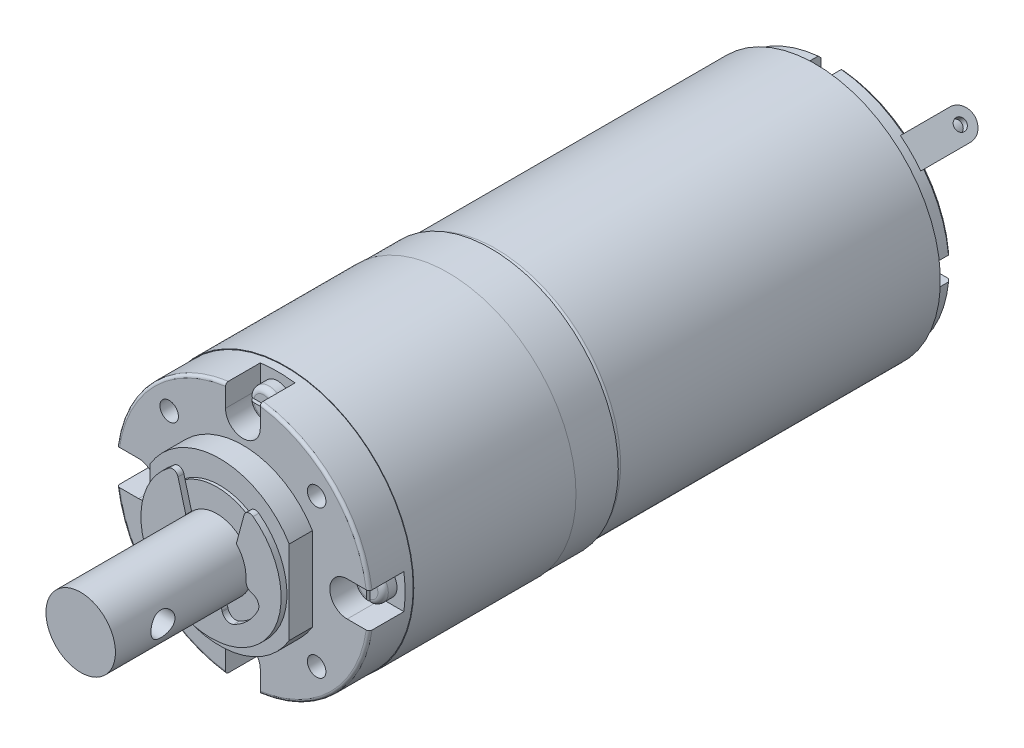
from build123d import *

# Parameters (mm, degrees)
SKETCH1_R           = 11
BOSS_EXTRUDE1_DEPTH = 25.45
SKETCH2_R           = 11
SKETCH2_R_2         = 10.8
CUT_EXTRUDE1_DEPTH  = 34.350412291
SKETCH5_R           = 0.8
CUT_EXTRUDE2_DEPTH  = 3
BOSS_EXTRUDE2_DEPTH = 2
SKETCH7_R           = 3
BOSS_EXTRUDE3_DEPTH = 12
CUT_EXTRUDE3_START  = -1
CUT_EXTRUDE3_DEPTH  = 1
CIRPATTERN1_COUNT   = 4
CIRPATTERN2_COUNT   = 4
SKETCH11_R          = 5
BOSS_EXTRUDE4_DEPTH = 0.25
SKETCH12_R          = 11.05
BOSS_EXTRUDE5_DEPTH = 7
SKETCH14_R          = 1.0375
CUT_EXTRUDE4_DEPTH  = 3
FILLET1_R           = 0.25
BOSS_EXTRUDE6_DEPTH = 0.5
FILLET2_R           = 0.5
CUT_EXTRUDE5_START  = -1.5
SKETCH16_R          = 10.8
SKETCH16_R_2        = 10.3
CUT_EXTRUDE5_DEPTH  = 1.5
CUT_EXTRUDE6_START  = -0.5
CUT_EXTRUDE6_DEPTH  = 0.5
CUT_EXTRUDE7_START  = -1.5
CUT_EXTRUDE7_DEPTH  = 1.5
CHAMFER1_SIZE       = 0.25
CUT_EXTRUDE8_DEPTH  = 0.5
SKETCH20_R          = 0.5
BOSS_EXTRUDE7_DEPTH = 0.5
CIRPATTERN4_COUNT   = 2
BOSS_EXTRUDE8_START = 2
SKETCH22_R          = 3
BOSS_EXTRUDE8_DEPTH = 2
SKETCH23_R          = 1
BOSS_EXTRUDE9_DEPTH = 9.2
CHAMFER2_SIZE       = 0.25


with BuildPart() as part:
    # Sketch1 → Boss-Extrude1 (new, symmetric)
    with BuildSketch(Plane.XY):
        with Locations(Location((0, 0, 0), (0, 0, 180))):
            Circle(SKETCH1_R)
    extrude(amount=BOSS_EXTRUDE1_DEPTH, both=True)

    # Sketch2 → Cut-Extrude1 (cut, through all)
    with BuildSketch(Plane(origin=(0, 0, 4.05), x_dir=(-1, 0, 0), z_dir=(0, 0, -1))):
        Circle(SKETCH2_R)
        Circle(SKETCH2_R_2, mode=Mode.SUBTRACT)
    extrude(amount=CUT_EXTRUDE1_DEPTH, mode=Mode.SUBTRACT)

    # Sketch5 → Cut-Extrude2 (cut)
    with BuildSketch(Plane.XY.offset(25.45)):
        with Locations((-6.363961031, 6.363961031)):
            Circle(SKETCH5_R)
        with Locations((6.363961031, 6.363961031)):
            Circle(SKETCH5_R)
        with Locations((6.363961031, -6.363961031)):
            Circle(SKETCH5_R)
        with Locations((-6.363961031, -6.363961031)):
            Circle(SKETCH5_R)
        with BuildLine():
            Line((-1.5, 9), (-1.5, 10.897247359))
            ThreePointArc((-1.5, 10.897247359), (0, 11), (1.5, 10.897247359))
            Line((1.5, 10.897247359), (1.5, 9))
            ThreePointArc((1.5, 9), (0, 7.5), (-1.5, 9))
        make_face()
        with BuildLine():
            Line((9, 1.5), (10.897247359, 1.5))
            ThreePointArc((10.897247359, 1.5), (11, 0), (10.897247359, -1.5))
            Line((10.897247359, -1.5), (9, -1.5))
            ThreePointArc((9, -1.5), (7.5, 0), (9, 1.5))
        make_face()
        with BuildLine():
            Line((1.5, -9), (1.5, -10.897247359))
            ThreePointArc((1.5, -10.897247359), (0, -11), (-1.5, -10.897247359))
            Line((-1.5, -10.897247359), (-1.5, -9))
            ThreePointArc((-1.5, -9), (0, -7.5), (1.5, -9))
        make_face()
        with BuildLine():
            Line((-9, -1.5), (-10.897247359, -1.5))
            ThreePointArc((-10.897247359, -1.5), (-11, 0), (-10.897247359, 1.5))
            Line((-10.897247359, 1.5), (-9, 1.5))
            ThreePointArc((-9, 1.5), (-7.5, 0), (-9, -1.5))
        make_face()
    extrude(amount=-CUT_EXTRUDE2_DEPTH, mode=Mode.SUBTRACT)

    # Sketch3 → Cut-Revolve3 (revolve, cut)
    with BuildSketch(Plane(origin=(0, 0, 0), x_dir=(0, 0, -1), z_dir=(1, 0, 0)), mode=Mode.PRIVATE) as cut_revolve3_sk:
        with BuildLine():
            ThreePointArc((-4.05, 10.4), (-3.932842712, 10.682842712), (-3.65, 10.8))
            Line((-3.65, 10.8), (-4.05, 10.8))
            Line((-4.05, 10.8), (-4.05, 10.4))
        make_face()
    revolve(cut_revolve3_sk.sketch.rotate(Axis((0, 0, -32.758521673), (0, 0, 1)), 90), axis=Axis((0, 0, -32.758521673), (0, 0, 1)), mode=Mode.SUBTRACT)

    # Sketch6 → Boss-Extrude2 (add)
    with BuildSketch(Plane.XY.offset(25.45)):
        with BuildLine():
            Line((-6, -3.605551275), (-6, 3.605551275))
            ThreePointArc((-6, 3.605551275), (0, 7), (6, 3.605551275))
            Line((6, 3.605551275), (6, -3.605551275))
            ThreePointArc((6, -3.605551275), (0, -7), (-6, -3.605551275))
        make_face()
    extrude(amount=BOSS_EXTRUDE2_DEPTH)

    # Sketch7 → Boss-Extrude3 (add)
    with BuildSketch(Plane.XY.offset(27.45)):
        Circle(SKETCH7_R)
    extrude(amount=BOSS_EXTRUDE3_DEPTH)

    # Sketch9 → Revolve1 (revolve)
    with BuildSketch(Plane(origin=(0, 9, 0), x_dir=(1, 0, 0), z_dir=(0, 1, 0)), mode=Mode.PRIVATE) as revolve1_sk:
        with BuildLine():
            Line((0, -22.45), (0, -23.65))
            Line((0, -23.65), (0.85, -23.65))
            ThreePointArc((0.85, -23.65), (1.168198052, -23.518198052), (1.3, -23.2))
            Line((1.3, -23.2), (1.3, -22.45))
            Line((1.3, -22.45), (0, -22.45))
        make_face()
    revolve1 = revolve(revolve1_sk.sketch.rotate(Axis((0, 9, 22.45), (0, 0, 1)), 180), axis=Axis((0, 9, 22.45), (0, 0, 1)))

    # Sketch10 → Cut-Extrude3 (cut)
    with BuildSketch(Plane.XY.offset(23.65).offset(CUT_EXTRUDE3_START)):
        with BuildLine():
            Line((0.15, 9.15), (1.291317157, 9.15))
            ThreePointArc((1.291317157, 9.15), (1.3, 9), (1.291317157, 8.85))
            Line((1.291317157, 8.85), (0.15, 8.85))
            Line((0.15, 8.85), (-0.15, 8.85))
            Line((-0.15, 8.85), (-1.291317157, 8.85))
            ThreePointArc((-1.291317157, 8.85), (-1.3, 9), (-1.291317157, 9.15))
            Line((-1.291317157, 9.15), (-0.15, 9.15))
            Line((-0.15, 9.15), (0.15, 9.15))
        make_face()
    cut_extrude3 = extrude(amount=CUT_EXTRUDE3_DEPTH, mode=Mode.SUBTRACT)

    # CirPattern1: Revolve1 ×4 about axis
    cirpattern1_axis = Axis((0, 0, 0), (0, 0, 1))
    for i in range(1, CIRPATTERN1_COUNT):
        add(revolve1.rotate(cirpattern1_axis, i * 360 / CIRPATTERN1_COUNT))

    # CirPattern2: Cut-Extrude3 ×4 about axis
    cirpattern2_axis = Axis((0, 0, -32.758521673), (0, 0, 1))
    for i in range(1, CIRPATTERN2_COUNT):
        add(cut_extrude3.rotate(cirpattern2_axis, i * 360 / CIRPATTERN2_COUNT), mode=Mode.SUBTRACT)

    # Sketch11 → Boss-Extrude4 (add)
    with BuildSketch(Plane.XY.offset(27.45)):
        Circle(SKETCH11_R)
    extrude(amount=BOSS_EXTRUDE4_DEPTH)

    # Sketch12 → Boss-Extrude5 (add, symmetric)
    with BuildSketch(Plane(origin=(0, 0, 14.75), x_dir=(-1, 0, 0), z_dir=(0, 0, -1))):
        Circle(SKETCH12_R)
    extrude(amount=BOSS_EXTRUDE5_DEPTH, both=True)

    # Sketch14 → Cut-Extrude4 (cut, symmetric)
    with BuildSketch(Plane(origin=(0, 0, 0), x_dir=(0, 0, -1), z_dir=(1, 0, 0))):
        with Locations((-35.35, 0)):
            Circle(SKETCH14_R)
    extrude(amount=CUT_EXTRUDE4_DEPTH, both=True, mode=Mode.SUBTRACT)

    # Fillet1
    fillet1_edges = [part.edges().sort_by_distance(p)[0] for p in [
        (-7.778174593, 7.778174593, 25.45),
        (-7.778174593, -7.778174593, 25.45),
        (7.778174593, -7.778174593, 25.45),
        (7.778174593, 7.778174593, 25.45),
    ]]
    fillet(fillet1_edges, radius=FILLET1_R)

    # Sketch15 → Boss-Extrude6 (add)
    with BuildSketch(Plane.XY.offset(27.7)):
        with BuildLine():
            Line((2.181072549, 2.088103643), (3.025884963, 5.240986493))
            ThreePointArc((3.025884963, 5.240986493), (0, -6.051769926), (-3.025884963, 5.240986493))
            Line((-3.025884963, 5.240986493), (-2.181072549, 2.088103643))
            ThreePointArc((-2.181072549, 2.088103643), (-2.840968583, 1.022815625), (-3.011553183, -0.218636037))
            ThreePointArc((-3.011553183, -0.218636037), (-3.139294978, -0.675056122), (-3.528542392, -0.945470084))
            Line((-3.528542392, -0.945470084), (-3.607703867, -0.966681338))
            ThreePointArc((-3.607703867, -0.966681338), (-4.062524818, -1.350406312), (-4.057733529, -1.945455887))
            ThreePointArc((-4.057733529, -1.945455887), (-3.181980515, -3.181980515), (-1.945455887, -4.057733529))
            ThreePointArc((-1.945455887, -4.057733529), (-1.350406312, -4.062524818), (-0.966681338, -3.607703867))
            Line((-0.966681338, -3.607703867), (-0.945470084, -3.528542392))
            ThreePointArc((-0.945470084, -3.528542392), (-0.675056122, -3.139294978), (-0.218636037, -3.011553183))
            ThreePointArc((-0.218636037, -3.011553183), (0, -3.019479142), (0.218636037, -3.011553183))
            ThreePointArc((0.218636037, -3.011553183), (0.675056122, -3.139294978), (0.945470084, -3.528542392))
            Line((0.945470084, -3.528542392), (0.966681338, -3.607703867))
            ThreePointArc((0.966681338, -3.607703867), (1.350406312, -4.062524818), (1.945455887, -4.057733529))
            ThreePointArc((1.945455887, -4.057733529), (3.181980515, -3.181980515), (4.057733529, -1.945455887))
            ThreePointArc((4.057733529, -1.945455887), (4.062524818, -1.350406312), (3.607703867, -0.966681338))
            Line((3.607703867, -0.966681338), (3.528542392, -0.945470084))
            ThreePointArc((3.528542392, -0.945470084), (3.139294978, -0.675056122), (3.011553183, -0.218636037))
            ThreePointArc((3.011553183, -0.218636037), (2.840968583, 1.022815625), (2.181072549, 2.088103643))
        make_face()
    extrude(amount=BOSS_EXTRUDE6_DEPTH)

    # Fillet2
    fillet2_edges = [part.edges().sort_by_distance(p)[0] for p in [
        (-3.025884963, 5.240986493, 27.95),
        (3.025884963, 5.240986493, 27.95),
    ]]
    fillet(fillet2_edges, radius=FILLET2_R)

    # Sketch16 → Cut-Extrude5 (cut)
    with BuildSketch(Plane(origin=(0, 0, -25.45), x_dir=(-1, 0, 0), z_dir=(0, 0, -1)).offset(CUT_EXTRUDE5_START)):
        Circle(SKETCH16_R)
        Circle(SKETCH16_R_2, mode=Mode.SUBTRACT)
    extrude(amount=CUT_EXTRUDE5_DEPTH, mode=Mode.SUBTRACT)

    # Sketch17 → Cut-Extrude6 (cut)
    with BuildSketch(Plane(origin=(0, 0, -25.45), x_dir=(-1, 0, 0), z_dir=(0, 0, -1)).offset(CUT_EXTRUDE6_START)):
        with BuildLine():
            Line((0, 8), (-1, 8))
            Line((-1, 8), (-1, 10.251341376))
            ThreePointArc((-1, 10.251341376), (0, 10.3), (1, 10.251341376))
            Line((1, 10.251341376), (1, 8))
            Line((1, 8), (0, 8))
        make_face()
        with BuildLine():
            Line((8, 1), (10.251341376, 1))
            ThreePointArc((10.251341376, 1), (10.3, 0), (10.251341376, -1))
            Line((10.251341376, -1), (8, -1))
            Line((8, -1), (8, 0))
            Line((8, 0), (8, 1))
        make_face()
        with BuildLine():
            Line((1, -8), (1, -10.251341376))
            ThreePointArc((1, -10.251341376), (0, -10.3), (-1, -10.251341376))
            Line((-1, -10.251341376), (-1, -8))
            Line((-1, -8), (0, -8))
            Line((0, -8), (1, -8))
        make_face()
        with BuildLine():
            Line((-8, -1), (-10.251341376, -1))
            ThreePointArc((-10.251341376, -1), (-10.3, 0), (-10.251341376, 1))
            Line((-10.251341376, 1), (-8, 1))
            Line((-8, 1), (-8, 0))
            Line((-8, 0), (-8, -1))
        make_face()
    extrude(amount=CUT_EXTRUDE6_DEPTH, mode=Mode.SUBTRACT)

    # Sketch18 → Cut-Extrude7 (cut)
    with BuildSketch(Plane(origin=(0, 0, -25.45), x_dir=(-1, 0, 0), z_dir=(0, 0, -1)).offset(CUT_EXTRUDE7_START)):
        with BuildLine():
            Line((-1, 10.251341376), (-1, 9.447221814))
            ThreePointArc((-1, 9.447221814), (0, 9.5), (1, 9.447221814))
            Line((1, 9.447221814), (1, 10.251341376))
            ThreePointArc((1, 10.251341376), (0, 10.3), (-1, 10.251341376))
        make_face()
        with BuildLine():
            Line((10.251341376, 1), (9.447221814, 1))
            ThreePointArc((9.447221814, 1), (9.5, 0), (9.447221814, -1))
            Line((9.447221814, -1), (10.251341376, -1))
            ThreePointArc((10.251341376, -1), (10.3, 0), (10.251341376, 1))
        make_face()
        with BuildLine():
            Line((1, -10.251341376), (1, -9.447221814))
            ThreePointArc((1, -9.447221814), (0, -9.5), (-1, -9.447221814))
            Line((-1, -9.447221814), (-1, -10.251341376))
            ThreePointArc((-1, -10.251341376), (0, -10.3), (1, -10.251341376))
        make_face()
        with BuildLine():
            Line((-10.251341376, -1), (-9.447221814, -1))
            ThreePointArc((-9.447221814, -1), (-9.5, 0), (-9.447221814, 1))
            Line((-9.447221814, 1), (-10.251341376, 1))
            ThreePointArc((-10.251341376, 1), (-10.3, 0), (-10.251341376, -1))
        make_face()
    extrude(amount=CUT_EXTRUDE7_DEPTH, mode=Mode.SUBTRACT)

    # Chamfer1
    chamfer1_edges = [part.edges().sort_by_distance(p)[0] for p in [
        (-7.283199846, 7.283199846, -25.45),
        (7.283199846, 7.283199846, -25.45),
        (7.283199846, -7.283199846, -25.45),
        (-7.283199846, -7.283199846, -25.45),
    ]]
    chamfer(chamfer1_edges, length=CHAMFER1_SIZE)

    # Sketch19 → Cut-Extrude8 (cut)
    with BuildSketch(Plane(origin=(0, 0, -25.45), x_dir=(-1, 0, 0), z_dir=(0, 0, -1))):
        with BuildLine():
            Line((-6.545347941, 4.777580988), (-8.313114894, 6.545347941))
            ThreePointArc((-8.313114894, 6.545347941), (-7.481626123, 7.481626123), (-6.545347941, 8.313114894))
            Line((-6.545347941, 8.313114894), (-4.777580988, 6.545347941))
            Line((-4.777580988, 6.545347941), (-6.545347941, 4.777580988))
        make_face()
        with BuildLine():
            Line((4.777580988, -6.545347941), (6.545347941, -8.313114894))
            ThreePointArc((6.545347941, -8.313114894), (7.481626123, -7.481626123), (8.313114894, -6.545347941))
            Line((8.313114894, -6.545347941), (6.545347941, -4.777580988))
            Line((6.545347941, -4.777580988), (4.777580988, -6.545347941))
        make_face()
    extrude(amount=-CUT_EXTRUDE8_DEPTH, mode=Mode.SUBTRACT)

    # Sketch20 → Boss-Extrude7 (add)
    with BuildSketch(Plane(origin=(5.661464464, 5.661464464, 0), x_dir=(0, 0, -1), z_dir=(0.7071067811865477, 0.7071067811865475, 0))):
        with BuildLine():
            Line((24.95, 1.25), (30.45, 1.25))
            ThreePointArc((30.45, 1.25), (31.7, 0), (30.45, -1.25))
            Line((30.45, -1.25), (24.95, -1.25))
            Line((24.95, -1.25), (24.95, 1.25))
        make_face()
        with Locations(Location((30.45, 0, 0), (0, 0, 90))):
            Circle(SKETCH20_R, mode=Mode.SUBTRACT)
    boss_extrude7 = extrude(amount=BOSS_EXTRUDE7_DEPTH)

    # CirPattern4: Boss-Extrude7 ×2 about axis
    cirpattern4_axis = Axis((0, 0, 0), (0, 0, 1))
    for i in range(1, CIRPATTERN4_COUNT):
        add(boss_extrude7.rotate(cirpattern4_axis, i * 360 / CIRPATTERN4_COUNT))

    # Sketch22 → Boss-Extrude8 (add)
    with BuildSketch(Plane(origin=(0, 0, -25.45), x_dir=(-1, 0, 0), z_dir=(0, 0, -1)).offset(BOSS_EXTRUDE8_START)):
        with Locations(Location((0, 0, 0), (0, 0, 180))):
            Circle(SKETCH22_R)
    extrude(amount=-BOSS_EXTRUDE8_DEPTH)

    # Sketch23 → Boss-Extrude9 (add)
    with BuildSketch(Plane(origin=(0, 0, -27.45), x_dir=(-1, 0, 0), z_dir=(0, 0, -1))):
        Circle(SKETCH23_R)
    extrude(amount=BOSS_EXTRUDE9_DEPTH)

    # Chamfer2
    chamfer2_edges = [part.edges().sort_by_distance(p)[0] for p in [
        (-3, 0, -27.45),
    ]]
    chamfer(chamfer2_edges, length=CHAMFER2_SIZE)


solid = part.part
